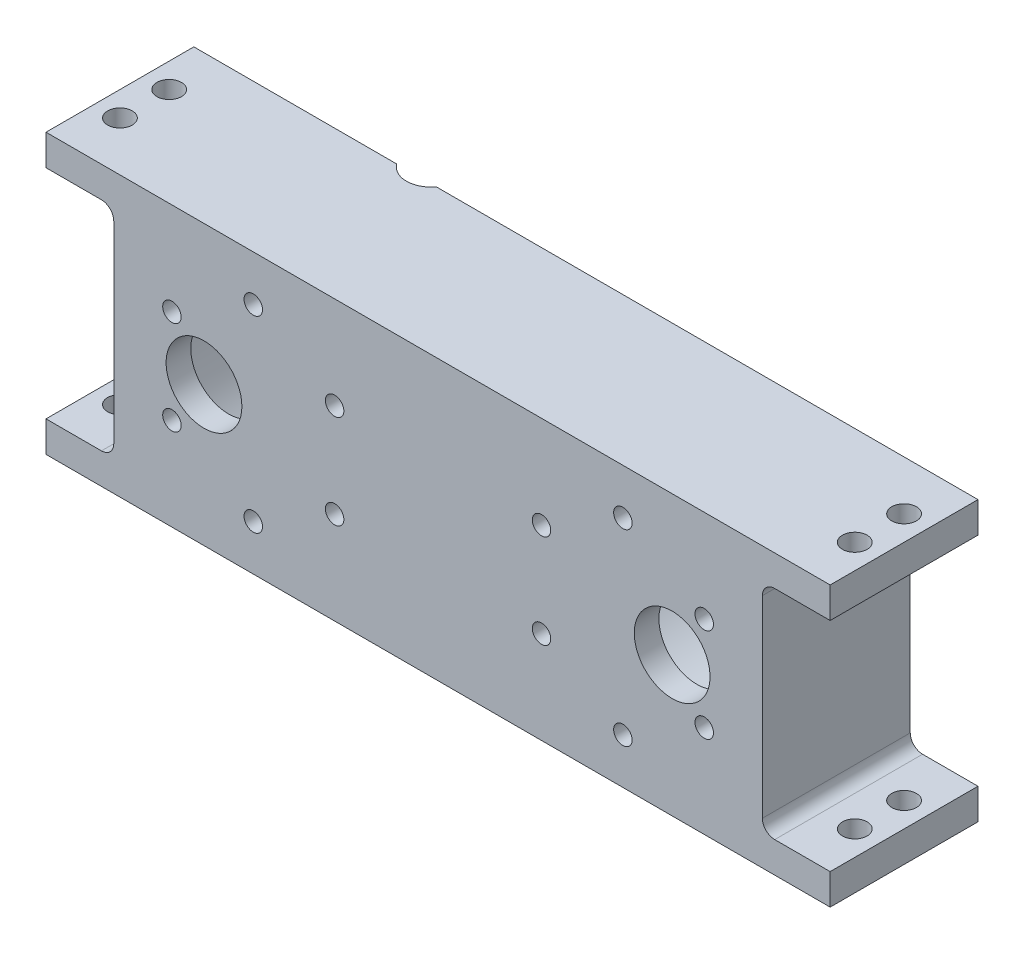
from build123d import *

# Parameters (mm, degrees)
SKETCH1_W           = 105.3
SKETCH1_H           = 45.3
SKETCH1_R           = 18.65
BOSS_EXTRUDE1_DEPTH = 20
SKETCH2_W           = 105.3
SKETCH2_H           = 45.3
SKETCH2_R           = 6.15
SKETCH2_R_2         = 1.5
BOSS_EXTRUDE2_DEPTH = 4
SKETCH3_W           = 11
SKETCH3_H           = 24
SKETCH3_R           = 2
BOSS_EXTRUDE3_DEPTH = 5
FILLET1_R           = 2
BOSS_EXTRUDE4_START = -5
SKETCH4_W           = 11
SKETCH4_H           = 24
SKETCH4_R           = 2
BOSS_EXTRUDE4_DEPTH = 5
FILLET2_R           = 2
SKETCH6_R           = 4
CUT_EXTRUDE1_DEPTH  = 20
SKETCH7_R           = 4.047183171
CUT_EXTRUDE2_DEPTH  = 20
SKETCH8_R           = 4
CUT_EXTRUDE3_DEPTH  = 20


with BuildPart() as part:
    # Sketch1 → Boss-Extrude1 (new body)
    with BuildSketch(Plane.XY):
        with Locations((30, 0)):
            Rectangle(SKETCH1_W, SKETCH1_H)
        Circle(SKETCH1_R, mode=Mode.SUBTRACT)
        with Locations(Location((60, 0, 0), (0, 0, 180))):
            Circle(SKETCH1_R, mode=Mode.SUBTRACT)
    extrude(amount=-BOSS_EXTRUDE1_DEPTH)

    # Sketch2 → Boss-Extrude2 (add)
    with BuildSketch(Plane.XY):
        with Locations((30, 0)):
            Rectangle(SKETCH2_W, SKETCH2_H)
        with Locations((-8, 0)):
            Circle(SKETCH2_R, mode=Mode.SUBTRACT)
        with Locations((0, 15.25)):
            Circle(SKETCH2_R_2, mode=Mode.SUBTRACT)
        with Locations((13.206887408, 7.625)):
            Circle(SKETCH2_R_2, mode=Mode.SUBTRACT)
        with Locations((13.206887408, -7.625)):
            Circle(SKETCH2_R_2, mode=Mode.SUBTRACT)
        with Locations((0, -15.25)):
            Circle(SKETCH2_R_2, mode=Mode.SUBTRACT)
        with Locations((-13.206887408, -7.625)):
            Circle(SKETCH2_R_2, mode=Mode.SUBTRACT)
        with Locations((-13.206887408, 7.625)):
            Circle(SKETCH2_R_2, mode=Mode.SUBTRACT)
        with Locations(Location((73.206887408, -7.625, 0), (0, 0, 180))):
            Circle(SKETCH2_R_2, mode=Mode.SUBTRACT)
        with Locations(Location((60, -15.25, 0), (0, 0, 180))):
            Circle(SKETCH2_R_2, mode=Mode.SUBTRACT)
        with Locations(Location((46.793112592, -7.625, 0), (0, 0, 180))):
            Circle(SKETCH2_R_2, mode=Mode.SUBTRACT)
        with Locations(Location((46.793112592, 7.625, 0), (0, 0, 180))):
            Circle(SKETCH2_R_2, mode=Mode.SUBTRACT)
        with Locations(Location((60, 15.25, 0), (0, 0, 180))):
            Circle(SKETCH2_R_2, mode=Mode.SUBTRACT)
        with Locations(Location((73.206887408, 7.625, 0), (0, 0, 180))):
            Circle(SKETCH2_R_2, mode=Mode.SUBTRACT)
        with Locations(Location((68, 0, 0), (0, 0, 180))):
            Circle(SKETCH2_R, mode=Mode.SUBTRACT)
    extrude(amount=BOSS_EXTRUDE2_DEPTH)

    # Sketch3 → Boss-Extrude3 (add)
    # profile 1 of 2: a face of its own
    with BuildSketch(Plane.XZ.offset(22.65)):
        with Locations((-28.15, -8)):
            Rectangle(SKETCH3_W, SKETCH3_H)
        with Locations(Location((-29.65, -4, 0), (0, 0, 270))):
            Circle(SKETCH3_R, mode=Mode.SUBTRACT)
        with Locations(Location((-29.65, -12, 0), (0, 0, 270))):
            Circle(SKETCH3_R, mode=Mode.SUBTRACT)
    # profile 2 of 2: a face of its own
    with BuildSketch(Plane.XZ.offset(22.65)):
        with Locations((88.15, -8)):
            Rectangle(SKETCH3_W, SKETCH3_H)
        with Locations(Location((89.65, -4, 0), (0, 0, 90))):
            Circle(SKETCH3_R, mode=Mode.SUBTRACT)
        with Locations(Location((89.65, -12, 0), (0, 0, 90))):
            Circle(SKETCH3_R, mode=Mode.SUBTRACT)
    extrude(amount=-BOSS_EXTRUDE3_DEPTH)

    # Fillet1
    fillet1_edges = [part.edges().sort_by_distance(p)[0] for p in [
        (-22.65, -17.65, -8),
        (82.65, -17.65, -8),
    ]]
    fillet(fillet1_edges, radius=FILLET1_R)

    # Sketch4 → Boss-Extrude4 (add)
    # profile 1 of 2: a face of its own
    with BuildSketch(Plane(origin=(0, 22.65, 0), x_dir=(1, 0, 0), z_dir=(0, 1, 0)).offset(BOSS_EXTRUDE4_START)):
        with Locations((-28.15, 8)):
            Rectangle(SKETCH4_W, SKETCH4_H)
        with Locations(Location((-29.65, 12, 0), (0, 0, 90))):
            Circle(SKETCH4_R, mode=Mode.SUBTRACT)
        with Locations(Location((-29.65, 4, 0), (0, 0, 90))):
            Circle(SKETCH4_R, mode=Mode.SUBTRACT)
    # profile 2 of 2: a face of its own
    with BuildSketch(Plane(origin=(0, 22.65, 0), x_dir=(1, 0, 0), z_dir=(0, 1, 0)).offset(BOSS_EXTRUDE4_START)):
        with Locations((88.15, 8)):
            Rectangle(SKETCH4_W, SKETCH4_H)
        with Locations(Location((89.65, 12, 0), (0, 0, 270))):
            Circle(SKETCH4_R, mode=Mode.SUBTRACT)
        with Locations(Location((89.65, 4, 0), (0, 0, 270))):
            Circle(SKETCH4_R, mode=Mode.SUBTRACT)
    extrude(amount=BOSS_EXTRUDE4_DEPTH)

    # Fillet2
    fillet2_edges = [part.edges().sort_by_distance(p)[0] for p in [
        (-22.65, 17.65, -8),
        (82.65, 17.65, -8),
    ]]
    fillet(fillet2_edges, radius=FILLET2_R)

    # Sketch6 → Cut-Extrude1 (cut)
    with BuildSketch(Plane.XZ.offset(22.65)):
        with Locations((2.5, -22.368602792)):
            Circle(SKETCH6_R)
        with Locations((2.5, -117.631397208)):
            Circle(SKETCH6_R)
    extrude(amount=-CUT_EXTRUDE1_DEPTH, mode=Mode.SUBTRACT)

    # Sketch7 → Cut-Extrude2 (cut)
    with BuildSketch(Plane.XZ.offset(22.65)):
        with Locations((2.5, -22.368602792)):
            Circle(SKETCH7_R)
    extrude(amount=-CUT_EXTRUDE2_DEPTH, mode=Mode.SUBTRACT)

    # Sketch8 → Cut-Extrude3 (cut)
    with BuildSketch(Plane(origin=(0, 22.65, 0), x_dir=(1, 0, 0), z_dir=(0, 1, 0))):
        with Locations((2.5, 22.368602792)):
            Circle(SKETCH8_R)
    extrude(amount=-CUT_EXTRUDE3_DEPTH, mode=Mode.SUBTRACT)


solid = part.part
